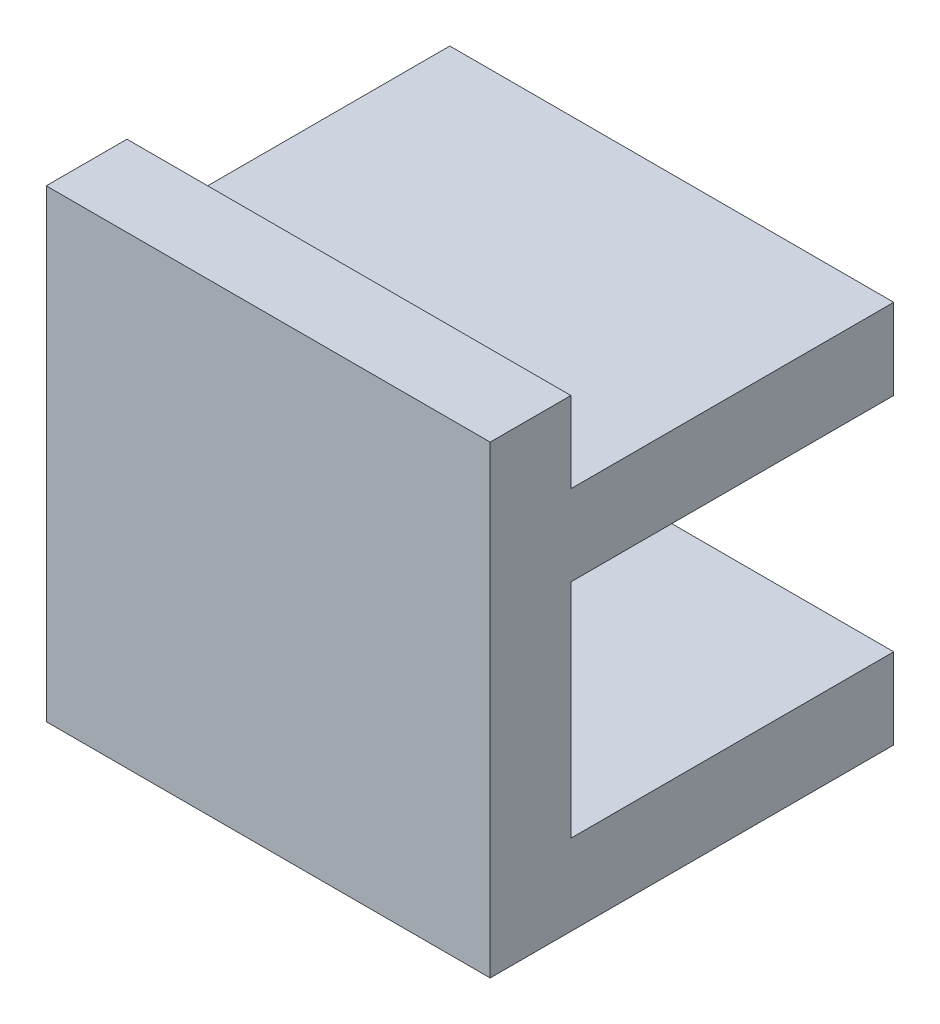
from build123d import *

# Parameters (mm, degrees)
SKETCH_1_W      = 20
SKETCH_1_H      = 115
SKETCH_1_W_2    = 80
SKETCH_1_H_2    = 20
EXTRUDE_1_DEPTH = 55


with BuildPart() as part:
    # Эскиз1 → Бобышка-Вытянуть1 (new, symmetric)
    with BuildSketch(Plane(origin=(0, 0, 0), x_dir=(0, 0, -1), z_dir=(1, 0, 0))):
        Rectangle(SKETCH_1_W, SKETCH_1_H)
        with Locations((50, -47.5)):
            Rectangle(SKETCH_1_W_2, SKETCH_1_H_2)
        with Locations((50, 27.5)):
            Rectangle(SKETCH_1_W_2, SKETCH_1_H_2)
    extrude(amount=EXTRUDE_1_DEPTH, both=True)


solid = part.part
